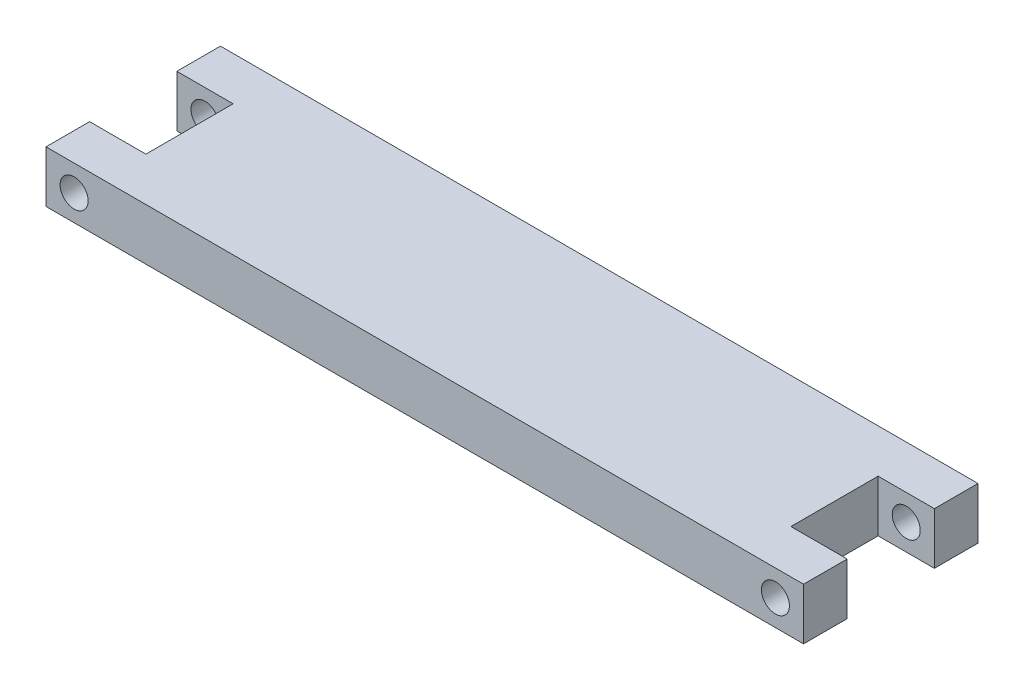
from build123d import *

# Parameters (mm, degrees)
SKETCH1_W           = 4.353701527
SKETCH1_H           = 3.374525205
SKETCH1_H_2         = 3.374525206
SKETCH1_W_2         = 4.353701528
BOSS_EXTRUDE1_DEPTH = 4
SKETCH2_R           = 1.084753974
CUT_EXTRUDE6_DEPTH  = 13.498101


with BuildPart() as part:
    # Sketch1 → Boss-Extrude1 (new body)
    with BuildSketch(Plane(origin=(0, 0, 0), x_dir=(1, 0, 0), z_dir=(0, 1, 0))):
        Polygon((4.353701527, 3.374525206), (4.353701527, 0), (54.259673219, 0), (54.259673219, 3.374525206), (54.259673219, 6.749050412), (54.259673219, 10.123575618), (54.259673219, 13.498100823), (4.353701527, 13.498100823), (4.353701527, 10.123575618), (4.353701527, 6.749050412), align=None)
        with Locations((2.176850764, 11.810838221)):
            Rectangle(SKETCH1_W, SKETCH1_H)
        with Locations((2.176850764, 1.687262603)):
            Rectangle(SKETCH1_W, SKETCH1_H_2)
        with Locations((56.436523983, 11.810838221)):
            Rectangle(SKETCH1_W_2, SKETCH1_H)
        with Locations((56.436523983, 1.687262603)):
            Rectangle(SKETCH1_W_2, SKETCH1_H_2)
    extrude(amount=BOSS_EXTRUDE1_DEPTH)

    # Sketch2 → Cut-Extrude6 (cut)
    with BuildSketch(Plane.XY):
        with Locations((2.176850764, 2)):
            Circle(SKETCH2_R)
        with Locations(Location((56.436523983, 2, 0), (0, 0, 180))):
            Circle(SKETCH2_R)
    extrude(amount=-CUT_EXTRUDE6_DEPTH, mode=Mode.SUBTRACT)


solid = part.part
